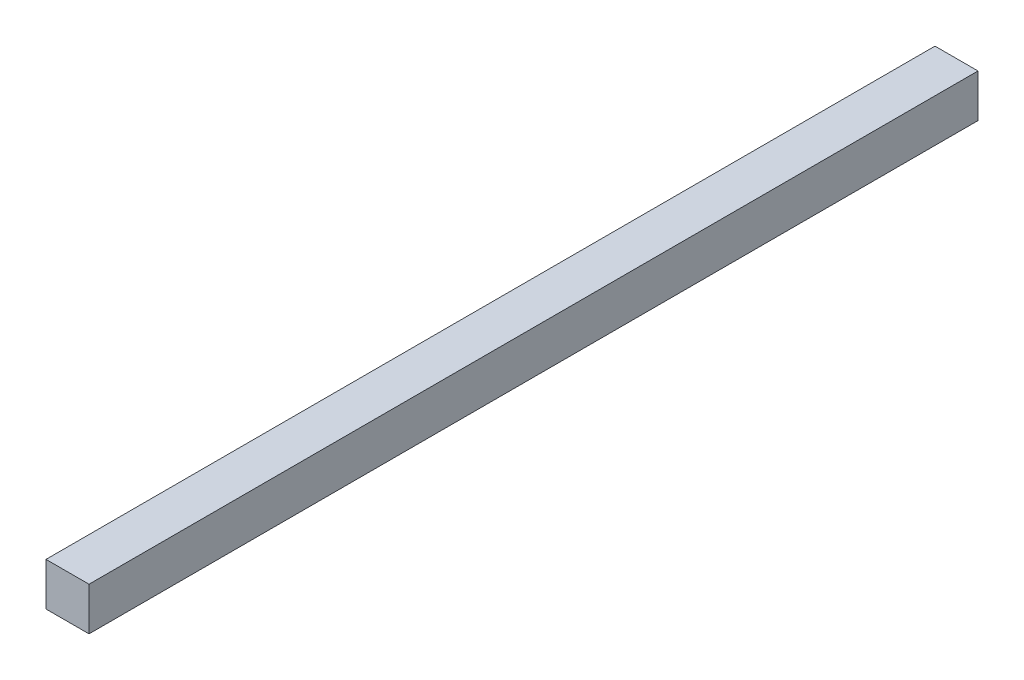
from build123d import *

# Parameters (mm, degrees)
SKETCH_6_W      = 15
SKETCH_6_H      = 15
EXTRUDE_2_DEPTH = 310


with BuildPart() as part:
    # 草图6 → 凸台-拉伸2 (new body)
    with BuildSketch(Plane.XY):
        with Locations((-4.759615385, 35.985576923)):
            Rectangle(SKETCH_6_W, SKETCH_6_H)
    extrude(amount=EXTRUDE_2_DEPTH)


solid = part.part
